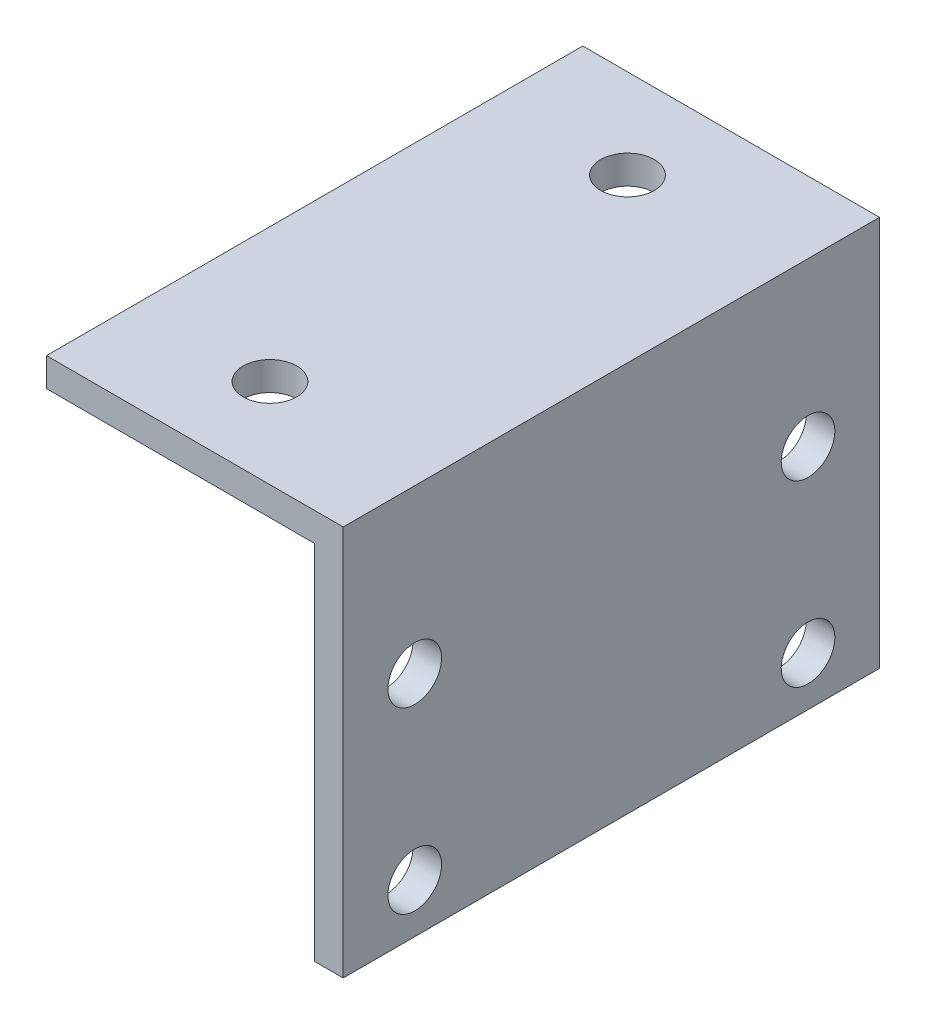
from build123d import *

# Parameters (mm, degrees)
ANGLE_DEPTH        = 30
SKETCH2_R          = 1.5
CUT_EXTRUDE1_DEPTH = 50
SKETCH3_R          = 1.5
CUT_EXTRUDE2_DEPTH = 50
SKETCH4_W          = 30
SKETCH4_H          = 3.15
CUT_EXTRUDE3_DEPTH = 50
SKETCH5_W          = 8.4
SKETCH5_H          = 30
CUT_EXTRUDE4_DEPTH = 50


with BuildPart() as part:
    # Sketch1 → Angle (new body)
    with BuildSketch(Plane.XY):
        Polygon((0, 0), (-23.4, 0), (-23.4, 1.6), (1.6, 1.6), (1.6, -23.4), (0, -23.4), align=None)
    extrude(amount=ANGLE_DEPTH)

    # Sketch2 → Cut-Extrude1 (cut)
    with BuildSketch(Plane.XZ):
        with Locations((-7.5, 5)):
            Circle(SKETCH2_R)
        with Locations((-7.5, 25)):
            Circle(SKETCH2_R)
    extrude(amount=-CUT_EXTRUDE1_DEPTH, mode=Mode.SUBTRACT)

    # Sketch3 → Cut-Extrude2 (cut)
    with BuildSketch(Plane.ZY):
        with Locations(Location((4, -7.5, 0), (0, 0, 270))):
            Circle(SKETCH3_R)
        with Locations(Location((26, -7.5, 0), (0, 0, 270))):
            Circle(SKETCH3_R)
        with Locations(Location((4, -17.5, 0), (0, 0, 270))):
            Circle(SKETCH3_R)
        with Locations(Location((26, -17.5, 0), (0, 0, 270))):
            Circle(SKETCH3_R)
    extrude(amount=-CUT_EXTRUDE2_DEPTH, mode=Mode.SUBTRACT)

    # Sketch4 → Cut-Extrude3 (cut)
    with BuildSketch(Plane.ZY):
        with Locations((15, -21.825)):
            Rectangle(SKETCH4_W, SKETCH4_H)
    extrude(amount=-CUT_EXTRUDE3_DEPTH, mode=Mode.SUBTRACT)

    # Sketch5 → Cut-Extrude4 (cut)
    with BuildSketch(Plane.XZ):
        with Locations((-19.2, 15)):
            Rectangle(SKETCH5_W, SKETCH5_H)
    extrude(amount=-CUT_EXTRUDE4_DEPTH, mode=Mode.SUBTRACT)


solid = part.part
